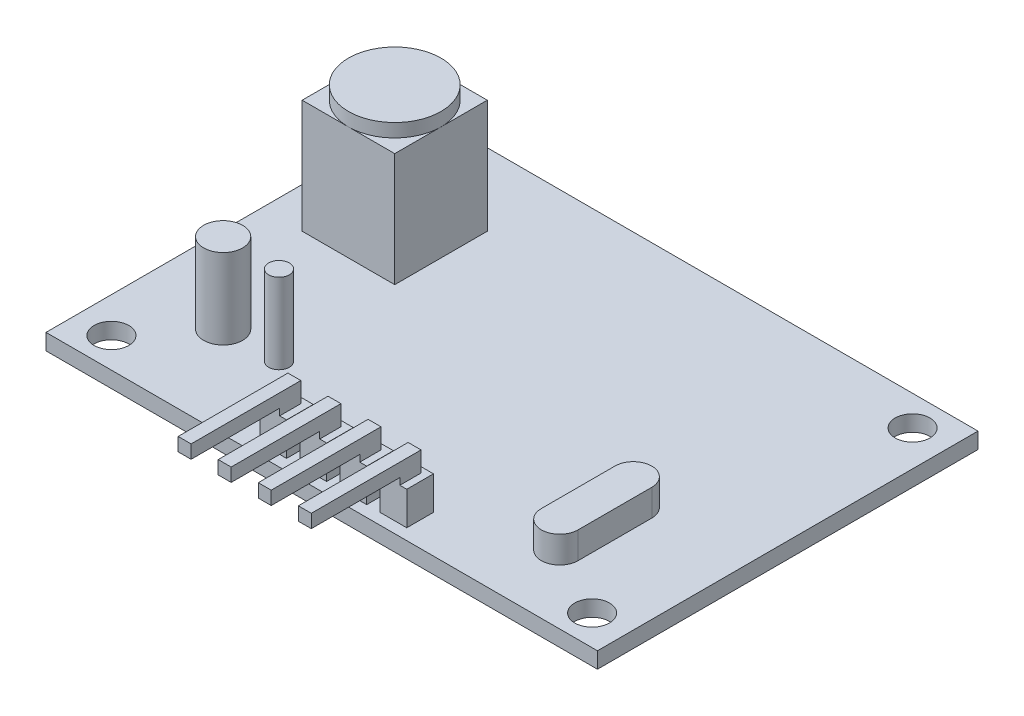
from build123d import *

# Parameters (mm, degrees)
SKETCH_1_W          = 41.3
SKETCH_1_H          = 28.5
EXTRUDE_1_DEPTH     = 1.2
SKETCH_2_R          = 3.466188446
EXTRUDE_2_DEPTH     = 9.5
SKETCH_3_W          = 7.4
SKETCH_3_H          = 5.8
EXTRUDE_3_DEPTH     = 7.1
HOLE_WIZARD_M2_1_D  = 2.6
SKETCH_6_W          = 0.968388925
SKETCH_6_H          = 8.634886507
EXTRUDE_4_DEPTH     = 4
SKETCH_7_W          = 6.634886507
SKETCH_7_H          = 3
CUT_EXTRUDE_1_DEPTH = 35.282372501
EXTRUDE_START       = -9.5
SKETCH_8_W          = 6.932376893
SKETCH_8_H          = 6.932376892
EXTRUDE_5_DEPTH     = 8.5
SKETCH_9_R          = 1.463933671
SKETCH_9_R_2        = 0.77068749
EXTRUDE_6_DEPTH     = 6
EXTRUDE_7_DEPTH     = 2
EXTRUDE_START_2     = -1.5
SKETCH_11_W         = 2
SKETCH_11_H         = 2
EXTRUDE_8_DEPTH     = 2.5
SKETCH_12_W         = 9.968388925
SKETCH_12_H         = 0.413345803
CUT_EXTRUDE_3_DEPTH = 1.5


with BuildPart() as part:
    # 草图1 → 凸台-拉伸1 (new body)
    with BuildSketch(Plane(origin=(0, 0, 0), x_dir=(1, 0, 0), z_dir=(0, 1, 0))):
        Rectangle(SKETCH_1_W, SKETCH_1_H)
    extrude(amount=EXTRUDE_1_DEPTH)

    # 草图2 → 凸台-拉伸2 (add)
    with BuildSketch(Plane(origin=(0, 1.2, 0), x_dir=(1, 0, 0), z_dir=(0, 1, 0))):
        with Locations(Location((-14.151249329, 5.368489825, 0), (0, 0, 270))):
            Circle(SKETCH_2_R)
    extrude(amount=EXTRUDE_2_DEPTH)

    # 草图3 → 凸台-拉伸3 (add)
    with BuildSketch(Plane.XZ):
        Rectangle(SKETCH_3_W, SKETCH_3_H)
    extrude(amount=EXTRUDE_3_DEPTH)

    # M2 间隙孔1 (through all)
    with Locations(Plane(origin=(0, 0, 0), x_dir=(-1, 0, 0), z_dir=(0, -1, 0))):
        with Locations((18, -12), (-18, -12), (-18, 12), (18, 12)):
            Hole(HOLE_WIZARD_M2_1_D / 2)

    # 草图6 → 凸台-拉伸4 (add)
    with BuildSketch(Plane(origin=(0, 1.2, 0), x_dir=(1, 0, 0), z_dir=(0, 1, 0))):
        with Locations((-4.46731767, -15.732556747)):
            Rectangle(SKETCH_6_W, SKETCH_6_H)
        with Locations((-1.46731767, -15.732556747)):
            Rectangle(SKETCH_6_W, SKETCH_6_H)
        with Locations((1.53268233, -15.732556747)):
            Rectangle(SKETCH_6_W, SKETCH_6_H)
        with Locations((4.53268233, -15.732556747)):
            Rectangle(SKETCH_6_W, SKETCH_6_H)
    extrude(amount=EXTRUDE_4_DEPTH)

    # 草图7 → 切除-拉伸1 (cut, through all)
    with BuildSketch(Plane(origin=(5.016876792, 0, 0), x_dir=(0, 0, -1), z_dir=(1, 0, 0))):
        with Locations((-16.732556747, 2.7)):
            Rectangle(SKETCH_7_W, SKETCH_7_H)
    extrude(amount=-CUT_EXTRUDE_1_DEPTH, mode=Mode.SUBTRACT)

    # 草图8 → 凸台-拉伸5 (add)
    with BuildSketch(Plane(origin=(0, 10.7, 0), x_dir=(1, 0, 0), z_dir=(0, 1, 0)).offset(EXTRUDE_START)):
        with Locations((-14.15124933, 5.368489825)):
            Rectangle(SKETCH_8_W, SKETCH_8_H)
    extrude(amount=EXTRUDE_5_DEPTH)

    # 草图9 → 凸台-拉伸6 (add)
    with BuildSketch(Plane(origin=(0, 1.2, 0), x_dir=(1, 0, 0), z_dir=(0, 1, 0))):
        with Locations(Location((-14.229613701, -7.405223715, 0), (0, 0, 270))):
            Circle(SKETCH_9_R)
        with Locations(Location((-10.0444332, -7.405223715, 0), (0, 0, 270))):
            Circle(SKETCH_9_R_2)
    extrude(amount=EXTRUDE_6_DEPTH)

    # 草图10 → 凸台-拉伸7 (add)
    with BuildSketch(Plane(origin=(0, 1.2, 0), x_dir=(1, 0, 0), z_dir=(0, 1, 0))):
        with BuildLine():
            Line((14.081901448, -3.613942556), (14.081901448, -9.128533333))
            ThreePointArc((14.081901448, -9.128533333), (12.703253753, -10.507181027), (11.324606059, -9.128533333))
            Line((11.324606059, -9.128533333), (11.324606059, -3.613942556))
            ThreePointArc((11.324606059, -3.613942556), (12.703253753, -2.235294862), (14.081901448, -3.613942556))
        make_face()
    extrude(amount=EXTRUDE_7_DEPTH)

    # 草图11 → 凸台-拉伸8 (add)
    with BuildSketch(Plane(origin=(0, 5.2, 0), x_dir=(1, 0, 0), z_dir=(0, 1, 0)).offset(EXTRUDE_START_2)):
        with Locations((-4.46731767, -12.415113493)):
            Rectangle(SKETCH_11_W, SKETCH_11_H)
        with Locations((-1.46731767, -12.415113493)):
            Rectangle(SKETCH_11_W, SKETCH_11_H)
        with Locations((4.53268233, -12.415113493)):
            Rectangle(SKETCH_11_W, SKETCH_11_H)
        with Locations((1.53268233, -12.415113493)):
            Rectangle(SKETCH_11_W, SKETCH_11_H)
    extrude(amount=-EXTRUDE_8_DEPTH)

    # 草图12 → 切除-拉伸3 (cut)
    with BuildSketch(Plane(origin=(0, 5.2, 0), x_dir=(1, 0, 0), z_dir=(0, 1, 0))):
        with Locations((0.03268233, -11.621786395)):
            Rectangle(SKETCH_12_W, SKETCH_12_H)
    extrude(amount=-CUT_EXTRUDE_3_DEPTH, mode=Mode.SUBTRACT)


solid = part.part
